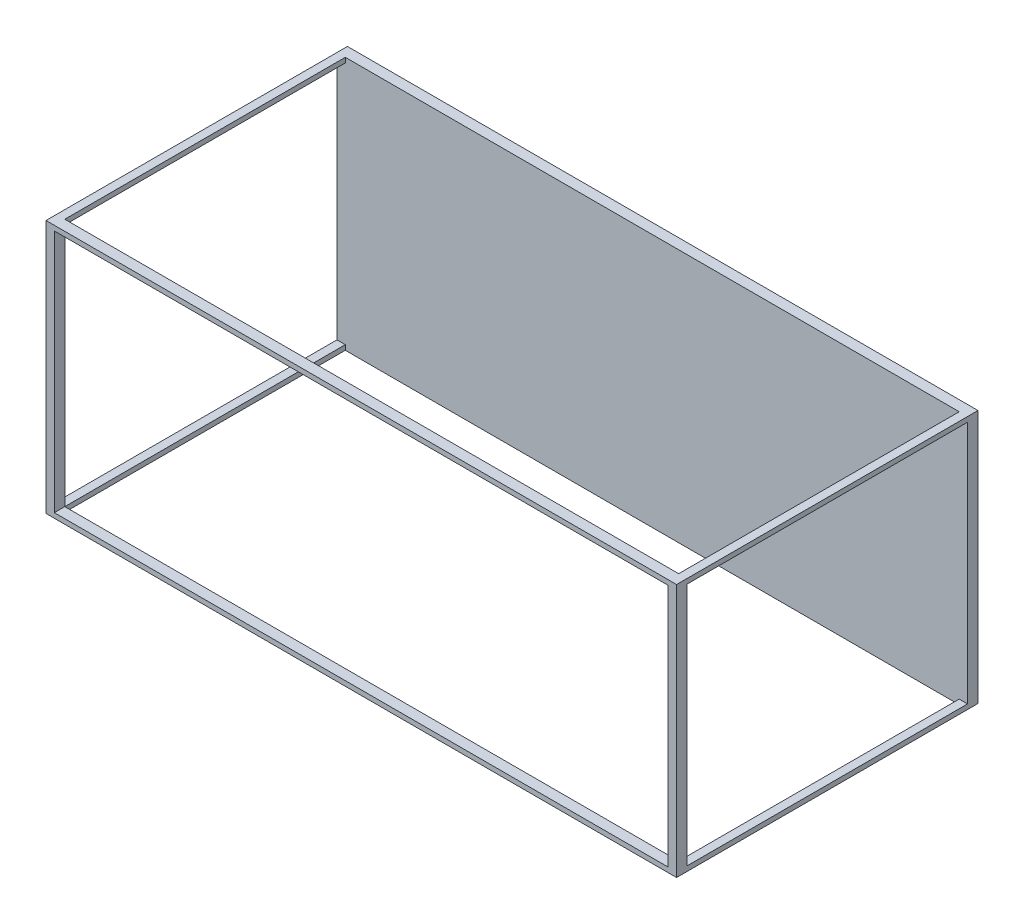
from build123d import *

# Parameters (mm, degrees)
SKETCH1_W               = 6058
SKETCH1_H               = 2438
BOSS_EXTRUDE1_DEPTH     = 2896
SKETCH4_W               = 5898
SKETCH4_H               = 2695
CUT_EXTRUDE1_DEPTH      = 4858.794444346
CUT_EXTRUDE2_DEPTH      = 4442.328605739
CUT_EXTRUDE2_DEPTH_BACK = 180
SKETCH8_W               = 5898
SKETCH8_H               = 2344
CUT_EXTRUDE3_DEPTH      = 6868.114162487
CUT_EXTRUDE3_DEPTH_BACK = 6868.114162487
SKETCH9_W               = 2695
SKETCH9_H               = 2344


with BuildPart() as part:
    # Sketch1 → Boss-Extrude1 (new body)
    with BuildSketch(Plane.XY):
        with Locations((-15.258015267, 220.123664122)):
            Rectangle(SKETCH1_W, SKETCH1_H)
    extrude(amount=BOSS_EXTRUDE1_DEPTH)

    # Sketch4 → Cut-Extrude1 (cut, through all)
    with BuildSketch(Plane.XZ.offset(998.876335878)):
        with Locations((-15.258015267, 1448)):
            Rectangle(SKETCH4_W, SKETCH4_H)
    extrude(amount=-CUT_EXTRUDE1_DEPTH, mode=Mode.SUBTRACT)

    # Sketch8 → Cut-Extrude2 (cut, two sides: drawn at the far end of the back side and taken through both)
    with BuildSketch(Plane.XY.offset(2896).offset(-CUT_EXTRUDE2_DEPTH_BACK)):
        with Locations((-15.258015267, 220.123664122)):
            Rectangle(SKETCH8_W, SKETCH8_H)
    extrude(amount=CUT_EXTRUDE2_DEPTH + CUT_EXTRUDE2_DEPTH_BACK, mode=Mode.SUBTRACT)

    # Sketch9 → Cut-Extrude3 (cut, two sides: drawn at the far end of the back side and taken through both)
    with BuildSketch(Plane.ZY.offset(3044.258015267).offset(-CUT_EXTRUDE3_DEPTH_BACK)):
        with Locations((1448, 220.123664122)):
            Rectangle(SKETCH9_W, SKETCH9_H)
    extrude(amount=CUT_EXTRUDE3_DEPTH + CUT_EXTRUDE3_DEPTH_BACK, mode=Mode.SUBTRACT)


solid = part.part
